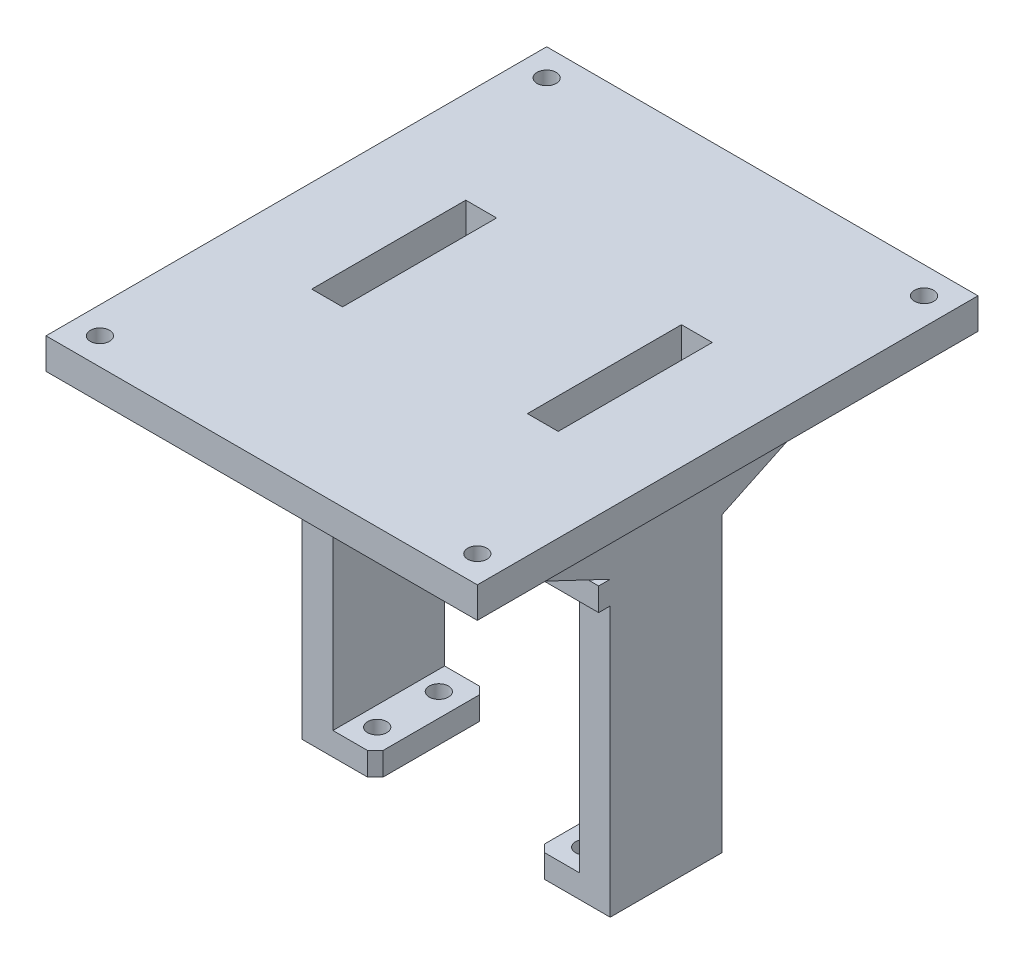
from build123d import *

# Parameters (mm, degrees)
EXTRUDE_1_DEPTH      = 65
CUT_EXTRUDE_2_REACH  = 99.185
SKETCH_2_R           = 1.25
CUT_EXTRUDE_4_REACH  = 99.185
SKETCH_10_R          = 1.25
CUT_EXTRUDE_8_DEPTH  = 98.185389848
CUT_EXTRUDE_9_REACH  = 99.185
CUT_EXTRUDE_10_REACH = 99.185
SKETCH_25_W          = 8.5
SKETCH_25_H          = 3
EXTRUDE_2_DEPTH      = 1.5
SKETCH_26_W          = 8.5
SKETCH_26_H          = 3
EXTRUDE_3_DEPTH      = 1.5
CUT_EXTRUDE_11_REACH = 99.185


with BuildPart() as part:
    # 草图1 → 凸台-拉伸1 (new body)
    with BuildSketch(Plane.XY):
        Polygon((9.5, 3), (4, 3), (4, 35), (9.5, 35), (9.5, 38), (4, 38), (4, 50), (36, 50), (36, 38), (30.5, 38), (30.5, 35), (36, 35), (36, 3), (30.5, 3), (30.5, 0), (40, 0), (40, 50), (48, 50), (48, 54), (-8, 54), (-8, 50), (0, 50), (0, 0), (9.5, 0), align=None)
    extrude(amount=EXTRUDE_1_DEPTH)

    # 草图2 → 切除-拉伸2 (cut, up to next)
    with BuildSketch(Plane(origin=(0, 54, 0), x_dir=(1, 0, 0), z_dir=(0, 1, 0)), mode=Mode.PRIVATE) as cut_extrude_2_sk1:
        with Locations(Location((-4.5, -61.5, 0), (0, 0, 270))):
            Circle(SKETCH_2_R)
    cut_extrude_2_tool1 = extrude(cut_extrude_2_sk1.sketch, amount=-CUT_EXTRUDE_2_REACH, mode=Mode.PRIVATE) & part.part
    # 草图2 → 切除-拉伸2 (cut, up to next)
    with BuildSketch(Plane(origin=(0, 54, 0), x_dir=(1, 0, 0), z_dir=(0, 1, 0)), mode=Mode.PRIVATE) as cut_extrude_2_sk2:
        with Locations(Location((44.5, -61.5, 0), (0, 0, 270))):
            Circle(SKETCH_2_R)
    cut_extrude_2_tool2 = extrude(cut_extrude_2_sk2.sketch, amount=-CUT_EXTRUDE_2_REACH, mode=Mode.PRIVATE) & part.part
    # 草图2 → 切除-拉伸2 (cut, up to next)
    with BuildSketch(Plane(origin=(0, 54, 0), x_dir=(1, 0, 0), z_dir=(0, 1, 0)), mode=Mode.PRIVATE) as cut_extrude_2_sk3:
        with Locations(Location((44.5, -3.5, 0), (0, 0, 270))):
            Circle(SKETCH_2_R)
    cut_extrude_2_tool3 = extrude(cut_extrude_2_sk3.sketch, amount=-CUT_EXTRUDE_2_REACH, mode=Mode.PRIVATE) & part.part
    # 草图2 → 切除-拉伸2 (cut, up to next)
    with BuildSketch(Plane(origin=(0, 54, 0), x_dir=(1, 0, 0), z_dir=(0, 1, 0)), mode=Mode.PRIVATE) as cut_extrude_2_sk4:
        with Locations(Location((-4.5, -3.5, 0), (0, 0, 270))):
            Circle(SKETCH_2_R)
    cut_extrude_2_tool4 = extrude(cut_extrude_2_sk4.sketch, amount=-CUT_EXTRUDE_2_REACH, mode=Mode.PRIVATE) & part.part
    add(cut_extrude_2_tool1.solids().sort_by_distance((-4.5, 54, 61.5))[0], mode=Mode.SUBTRACT)
    add(cut_extrude_2_tool2.solids().sort_by_distance((44.5, 54, 61.5))[0], mode=Mode.SUBTRACT)
    add(cut_extrude_2_tool3.solids().sort_by_distance((44.5, 54, 3.5))[0], mode=Mode.SUBTRACT)
    add(cut_extrude_2_tool4.solids().sort_by_distance((-4.5, 54, 3.5))[0], mode=Mode.SUBTRACT)

    # 切除-拉伸4: up to this face of the body (flat: up to its plane)
    cut_extrude_4_end = Plane(part.part.faces().sort_by_distance((6.75, 38, 32.5))[0])
    # 草图10 → 切除-拉伸4 (cut, up to the picked face)
    with BuildSketch(Plane.XZ, mode=Mode.PRIVATE) as cut_extrude_4_sk1:
        with Locations((33.5, 36.5)):
            Circle(SKETCH_10_R)
    cut_extrude_4_tool1 = split(extrude(cut_extrude_4_sk1.sketch, amount=-CUT_EXTRUDE_4_REACH, mode=Mode.PRIVATE), bisect_by=cut_extrude_4_end, keep=Keep.BOTH, mode=Mode.PRIVATE)
    # 草图10 → 切除-拉伸4 (cut, up to the picked face)
    with BuildSketch(Plane.XZ, mode=Mode.PRIVATE) as cut_extrude_4_sk2:
        with Locations((33.5, 28.5)):
            Circle(SKETCH_10_R)
    cut_extrude_4_tool2 = split(extrude(cut_extrude_4_sk2.sketch, amount=-CUT_EXTRUDE_4_REACH, mode=Mode.PRIVATE), bisect_by=cut_extrude_4_end, keep=Keep.BOTH, mode=Mode.PRIVATE)
    # 草图10 → 切除-拉伸4 (cut, up to the picked face)
    with BuildSketch(Plane.XZ, mode=Mode.PRIVATE) as cut_extrude_4_sk3:
        with Locations(Location((6.5, 28.5, 0), (0, 0, 270))):
            Circle(SKETCH_10_R)
    cut_extrude_4_tool3 = split(extrude(cut_extrude_4_sk3.sketch, amount=-CUT_EXTRUDE_4_REACH, mode=Mode.PRIVATE), bisect_by=cut_extrude_4_end, keep=Keep.BOTH, mode=Mode.PRIVATE)
    # 草图10 → 切除-拉伸4 (cut, up to the picked face)
    with BuildSketch(Plane.XZ, mode=Mode.PRIVATE) as cut_extrude_4_sk4:
        with Locations(Location((6.5, 36.5, 0), (0, 0, 270))):
            Circle(SKETCH_10_R)
    cut_extrude_4_tool4 = split(extrude(cut_extrude_4_sk4.sketch, amount=-CUT_EXTRUDE_4_REACH, mode=Mode.PRIVATE), bisect_by=cut_extrude_4_end, keep=Keep.BOTH, mode=Mode.PRIVATE)
    add(cut_extrude_4_tool1.solids().sort_by(Axis((33.5, 0, 36.5), (0, 1, 0)))[0], mode=Mode.SUBTRACT)
    add(cut_extrude_4_tool2.solids().sort_by(Axis((33.5, 0, 28.5), (0, 1, 0)))[0], mode=Mode.SUBTRACT)
    add(cut_extrude_4_tool3.solids().sort_by(Axis((6.5, 0, 28.5), (0, 1, 0)))[0], mode=Mode.SUBTRACT)
    add(cut_extrude_4_tool4.solids().sort_by(Axis((6.5, 0, 36.5), (0, 1, 0)))[0], mode=Mode.SUBTRACT)

    # 草图20 → 切除-拉伸8 (cut, through all)
    with BuildSketch(Plane.ZY):
        Polygon((0, 50), (0, 0), (25.25, 0), (25.25, 38), align=None)
        Polygon((65, 50), (65, 0), (39.75, 0), (39.75, 38), align=None)
    extrude(amount=-CUT_EXTRUDE_8_DEPTH, mode=Mode.SUBTRACT)

    # 切除-拉伸9: up to this face of the body (flat: up to its plane)
    cut_extrude_9_end = Plane(part.part.faces().sort_by_distance((33.214903751, 38, 32.5))[0])
    # 草图21 → 切除-拉伸9 (cut, up to the picked face)
    with BuildSketch(Plane.XZ, mode=Mode.PRIVATE) as cut_extrude_9_sk1:
        Polygon((30.5, 38.75), (31.5, 39.75), (30.5, 39.75), align=None)
    cut_extrude_9_tool1 = split(extrude(cut_extrude_9_sk1.sketch, amount=-CUT_EXTRUDE_9_REACH, mode=Mode.PRIVATE), bisect_by=cut_extrude_9_end, keep=Keep.BOTH, mode=Mode.PRIVATE)
    # 草图21 → 切除-拉伸9 (cut, up to the picked face)
    with BuildSketch(Plane.XZ, mode=Mode.PRIVATE) as cut_extrude_9_sk2:
        Polygon((30.5, 26.25), (31.5, 25.25), (30.5, 25.25), align=None)
    cut_extrude_9_tool2 = split(extrude(cut_extrude_9_sk2.sketch, amount=-CUT_EXTRUDE_9_REACH, mode=Mode.PRIVATE), bisect_by=cut_extrude_9_end, keep=Keep.BOTH, mode=Mode.PRIVATE)
    add(cut_extrude_9_tool1.solids().sort_by(Axis((30.833333, 0, 39.416667), (0, 1, 0)))[0], mode=Mode.SUBTRACT)
    add(cut_extrude_9_tool2.solids().sort_by(Axis((30.833333, 0, 25.583333), (0, 1, 0)))[0], mode=Mode.SUBTRACT)

    # 切除-拉伸10: up to this face of the body (flat: up to its plane)
    cut_extrude_10_end = Plane(part.part.faces().sort_by_distance((6.785096249, 38, 32.5))[0])
    # 草图22 → 切除-拉伸10 (cut, up to the picked face)
    with BuildSketch(Plane(origin=(0, 0, 0), x_dir=(-1, 0, 0), z_dir=(0, -1, 0)), mode=Mode.PRIVATE) as cut_extrude_10_sk1:
        Polygon((-8.5, -39.75), (-9.5, -38.75), (-9.5, -39.75), align=None)
    cut_extrude_10_tool1 = split(extrude(cut_extrude_10_sk1.sketch, amount=-CUT_EXTRUDE_10_REACH, mode=Mode.PRIVATE), bisect_by=cut_extrude_10_end, keep=Keep.BOTH, mode=Mode.PRIVATE)
    # 草图22 → 切除-拉伸10 (cut, up to the picked face)
    with BuildSketch(Plane(origin=(0, 0, 0), x_dir=(-1, 0, 0), z_dir=(0, -1, 0)), mode=Mode.PRIVATE) as cut_extrude_10_sk2:
        Polygon((-9.5, -25.25), (-8.5, -25.25), (-9.5, -26.25), align=None)
    cut_extrude_10_tool2 = split(extrude(cut_extrude_10_sk2.sketch, amount=-CUT_EXTRUDE_10_REACH, mode=Mode.PRIVATE), bisect_by=cut_extrude_10_end, keep=Keep.BOTH, mode=Mode.PRIVATE)
    add(cut_extrude_10_tool1.solids().sort_by(Axis((9.166667, 0, 39.416667), (0, 1, 0)))[0], mode=Mode.SUBTRACT)
    add(cut_extrude_10_tool2.solids().sort_by(Axis((9.166667, 0, 25.583333), (0, 1, 0)))[0], mode=Mode.SUBTRACT)

    # 草图25 → 凸台-拉伸2 (add)
    with BuildSketch(Plane.XY.offset(39.75)):
        with Locations((4.25, 36.5)):
            Rectangle(SKETCH_25_W, SKETCH_25_H)
    extrude(amount=EXTRUDE_2_DEPTH)

    # 草图26 → 凸台-拉伸3 (add)
    with BuildSketch(Plane.XY.offset(39.75)):
        with Locations((35.75, 36.5)):
            Rectangle(SKETCH_26_W, SKETCH_26_H)
    extrude(amount=EXTRUDE_3_DEPTH)

    # 草图27 → 切除-拉伸11 (cut, up to next)
    with BuildSketch(Plane(origin=(0, 54, 0), x_dir=(1, 0, 0), z_dir=(0, 1, 0)), mode=Mode.PRIVATE) as cut_extrude_11_sk1:
        Polygon((4, -32.5), (4, -22.5), (8, -22.5), (8, -42.5), (4, -42.5), align=None)
    cut_extrude_11_tool1 = extrude(cut_extrude_11_sk1.sketch, amount=-CUT_EXTRUDE_11_REACH, mode=Mode.PRIVATE) & part.part
    # 草图27 → 切除-拉伸11 (cut, up to next)
    with BuildSketch(Plane(origin=(0, 54, 0), x_dir=(1, 0, 0), z_dir=(0, 1, 0)), mode=Mode.PRIVATE) as cut_extrude_11_sk2:
        Polygon((36, -32.5), (36, -22.5), (32, -22.5), (32, -42.5), (36, -42.5), align=None)
    cut_extrude_11_tool2 = extrude(cut_extrude_11_sk2.sketch, amount=-CUT_EXTRUDE_11_REACH, mode=Mode.PRIVATE) & part.part
    add(cut_extrude_11_tool1.solids().sort_by_distance((6, 54, 32.5))[0], mode=Mode.SUBTRACT)
    add(cut_extrude_11_tool2.solids().sort_by_distance((34, 54, 32.5))[0], mode=Mode.SUBTRACT)


solid = part.part
